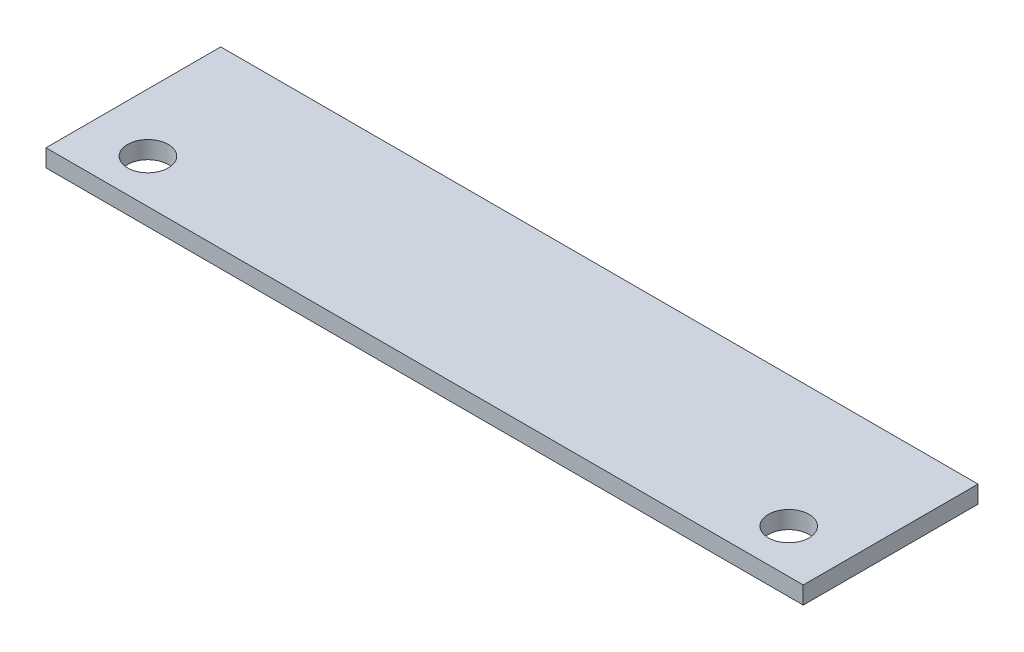
from build123d import *

# Parameters (mm, degrees)
SKETCH1_W               = 260
SKETCH1_H               = 60
BOSS_EXTRUDE1_DEPTH     = 6
CUT_EXTRUDE1_DEPTH      = 134.551488198
CUT_EXTRUDE1_DEPTH_BACK = 134.551488198
SKETCH2_R               = 7


with BuildPart() as part:
    # Sketch1 → Boss-Extrude1 (new body)
    with BuildSketch(Plane(origin=(0, 0, 0), x_dir=(1, 0, 0), z_dir=(0, 1, 0))):
        Rectangle(SKETCH1_W, SKETCH1_H)
    extrude(amount=BOSS_EXTRUDE1_DEPTH)

    # Sketch2 → Cut-Extrude1 (cut, two sides: drawn at the far end of the back side and taken through both)
    with BuildSketch(Plane(origin=(0, 6, 0), x_dir=(1, 0, 0), z_dir=(0, 1, 0)).offset(-CUT_EXTRUDE1_DEPTH_BACK)):
        with Locations(Location((110, -15, 0), (0, 0, 270))):
            Circle(SKETCH2_R)
        with Locations(Location((-110, -15, 0), (0, 0, 270))):
            Circle(SKETCH2_R)
    extrude(amount=CUT_EXTRUDE1_DEPTH + CUT_EXTRUDE1_DEPTH_BACK, mode=Mode.SUBTRACT)


solid = part.part
